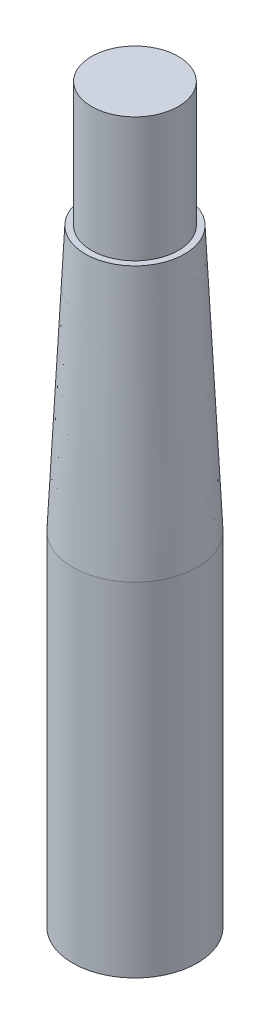
from build123d import *

# Parameters (mm, degrees)
SKETCH1_R           = 4
BOSS_EXTRUDE1_DEPTH = 22
SKETCH2_R           = 4
BOSS_EXTRUDE2_DEPTH = 17
BOSS_EXTRUDE2_TAPER = 2.75
SKETCH3_R           = 2.786556444
BOSS_EXTRUDE3_DEPTH = 8


with BuildPart() as part:
    # Sketch1 → Boss-Extrude1 (new body)
    with BuildSketch(Plane(origin=(0, 0, 0), x_dir=(1, 0, 0), z_dir=(0, 1, 0))):
        with Locations(Location((0, 0, 0), (0, 0, 270))):
            Circle(SKETCH1_R)
    extrude(amount=BOSS_EXTRUDE1_DEPTH)

    # Sketch2 → Boss-Extrude2 (add)
    with BuildSketch(Plane(origin=(0, 22, 0), x_dir=(1, 0, 0), z_dir=(0, 1, 0))):
        with Locations(Location((0, 0, 0), (0, 0, 270))):
            Circle(SKETCH2_R)
    extrude(amount=BOSS_EXTRUDE2_DEPTH, taper=BOSS_EXTRUDE2_TAPER)

    # Sketch3 → Boss-Extrude3 (add)
    with BuildSketch(Plane(origin=(0, 39, 0), x_dir=(1, 0, 0), z_dir=(0, 1, 0))):
        with Locations(Location((0, 0, 0), (0, 0, 270))):
            Circle(SKETCH3_R)
    extrude(amount=BOSS_EXTRUDE3_DEPTH)


solid = part.part
